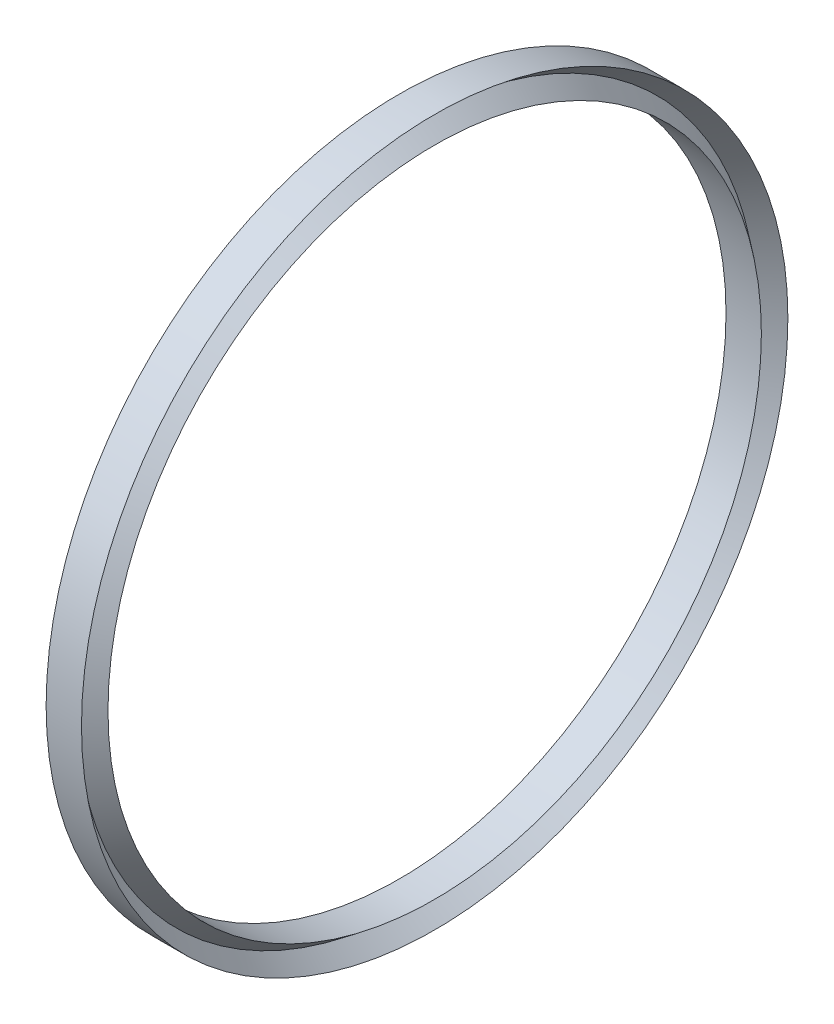
from build123d import *


with BuildPart() as part:
    # Sketch1 → Revolve-Thin4 (revolve)
    with BuildSketch(Plane.XY, mode=Mode.PRIVATE) as revolve_thin4_sk:
        Polygon((-65.831423575, -38.5), (-63.830090242, -36.999), (-67.834090242, -36.999), (-67.834090242, -40.001), (-63.830090242, -40.001), align=None)
        Polygon((-65.833090242, -38.5), (-63.833090242, -37), (-67.833090242, -37), (-67.833090242, -40), (-63.833090242, -40), align=None, mode=Mode.SUBTRACT)
    revolve(revolve_thin4_sk.sketch.rotate(Axis((-81.578167515, 0, 0), (1, 0, 0)), 270), axis=Axis((-81.578167515, 0, 0), (1, 0, 0)))


solid = part.part
